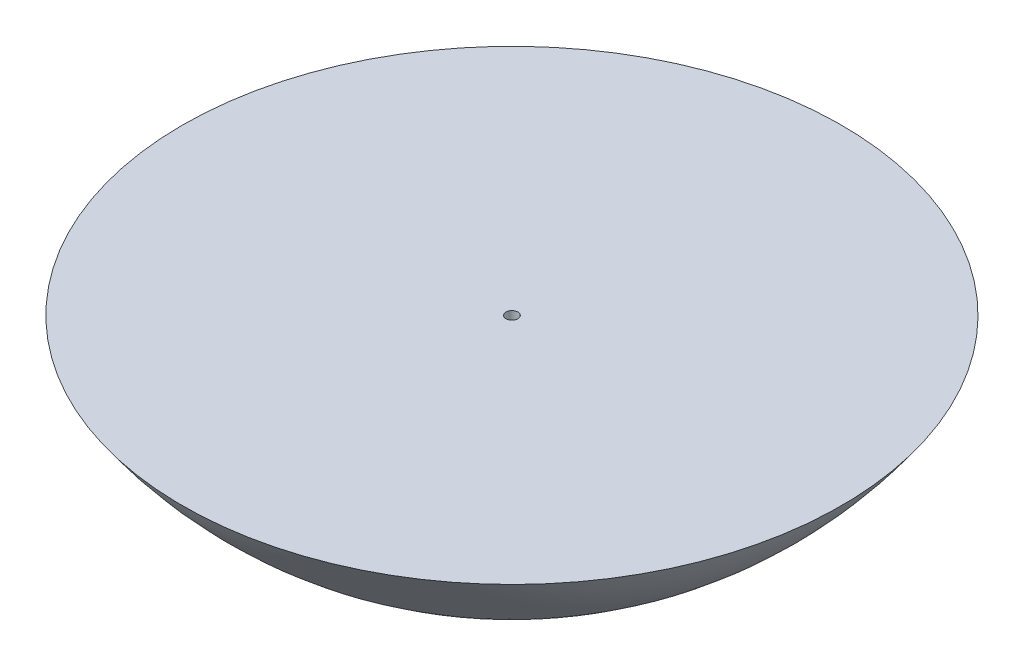
from build123d import *

# Parameters (mm, degrees)
SKETCH2_R           = 33.8
CUT_EXTRUDE1_DEPTH  = 19.1
SKETCH20_R          = 0.5
CUT_EXTRUDE13_DEPTH = 43.087409044


with BuildPart() as part:
    # Sketch1 → Revolve1 (revolve)
    with BuildSketch(Plane.XY, mode=Mode.PRIVATE) as revolve1_sk:
        with BuildLine():
            Line((0, -33.8), (0, 0))
            Line((0, 0), (33.8, 0))
            ThreePointArc((33.8, 0), (23.900209204, -23.900209204), (0, -33.8))
        make_face()
    revolve(revolve1_sk.sketch.rotate(Axis((0, -33.8, 0), (0, 1, 0)), 180), axis=Axis((0, -33.8, 0), (0, 1, 0)))

    # Sketch2 → Cut-Extrude1 (cut)
    with BuildSketch(Plane(origin=(0, 0, 0), x_dir=(1, 0, 0), z_dir=(0, 1, 0))):
        Circle(SKETCH2_R)
    extrude(amount=-CUT_EXTRUDE1_DEPTH, mode=Mode.SUBTRACT)

    # Sketch20 → Cut-Extrude13 (cut, through all)
    with BuildSketch(Plane(origin=(0, -19.1, 0), x_dir=(1, 0, 0), z_dir=(0, 1, 0))):
        with Locations(Location((0, 0, 0), (0, 0, 270))):
            Circle(SKETCH20_R)
    extrude(amount=-CUT_EXTRUDE13_DEPTH, mode=Mode.SUBTRACT)


solid = part.part
